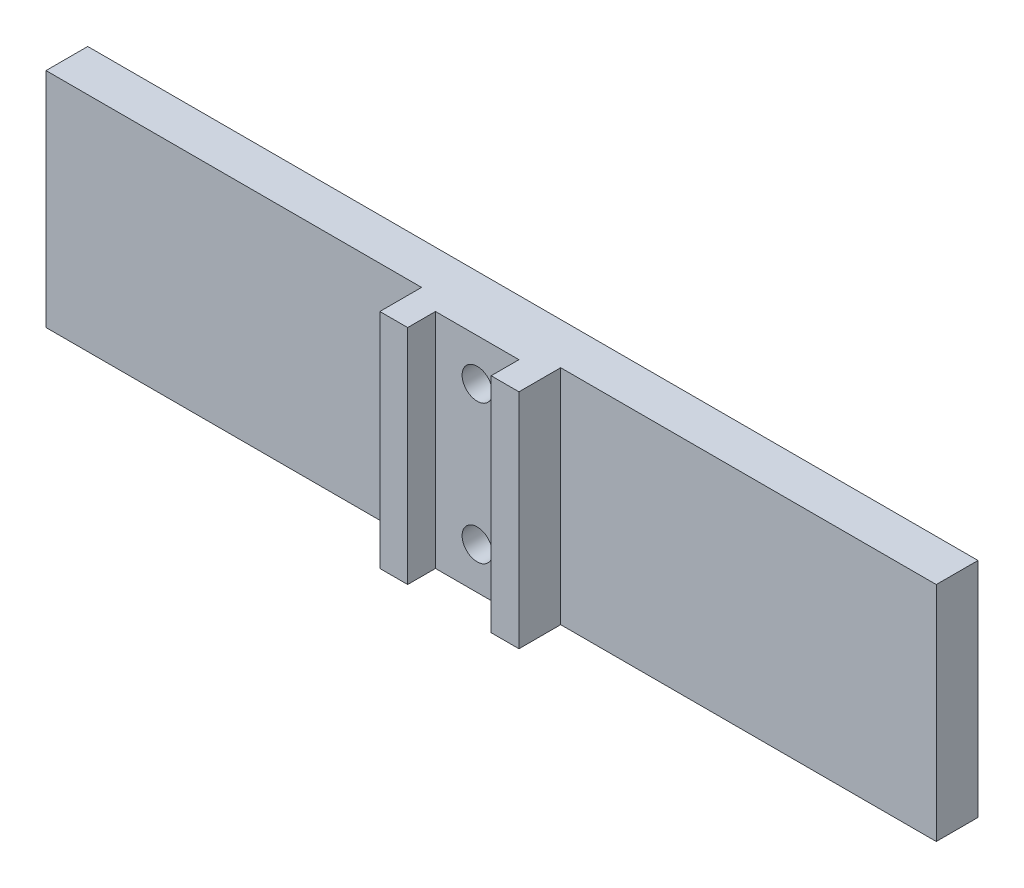
from build123d import *

# Parameters (mm, degrees)
SKETCH1_W             = 101.6
SKETCH1_H             = 25.4
BOSS_EXTRUDE1_DEPTH   = 9.525
SKETCH2_W             = 9.525
SKETCH2_H             = 3.175
SKETCH2_W_2           = 42.8625
SKETCH2_H_2           = 4.7625
CUT_EXTRUDE1_DEPTH    = 106.159144277
F_8_32_TAPPED_HOLE1_D = 3.4544


with BuildPart() as part:
    # Sketch1 → Boss-Extrude1 (new body)
    with BuildSketch(Plane.XY):
        with Locations((50.8, 12.7)):
            Rectangle(SKETCH1_W, SKETCH1_H)
    extrude(amount=BOSS_EXTRUDE1_DEPTH)

    # Sketch2 → Cut-Extrude1 (cut, through all)
    with BuildSketch(Plane(origin=(0, 25.4, 0), x_dir=(1, 0, 0), z_dir=(0, 1, 0))):
        with Locations((50.8, -7.9375)):
            Rectangle(SKETCH2_W, SKETCH2_H)
        with Locations((21.43125, -7.14375)):
            Rectangle(SKETCH2_W_2, SKETCH2_H_2)
        with Locations((80.16875, -7.14375)):
            Rectangle(SKETCH2_W_2, SKETCH2_H_2)
    extrude(amount=-CUT_EXTRUDE1_DEPTH, mode=Mode.SUBTRACT)

    # #8-32 Tapped Hole1 (through all)
    with Locations(Plane.XY.offset(6.35)):
        with Locations((50.8, 4.7625), (50.8, 20.6375)):
            Hole(F_8_32_TAPPED_HOLE1_D / 2)


solid = part.part
